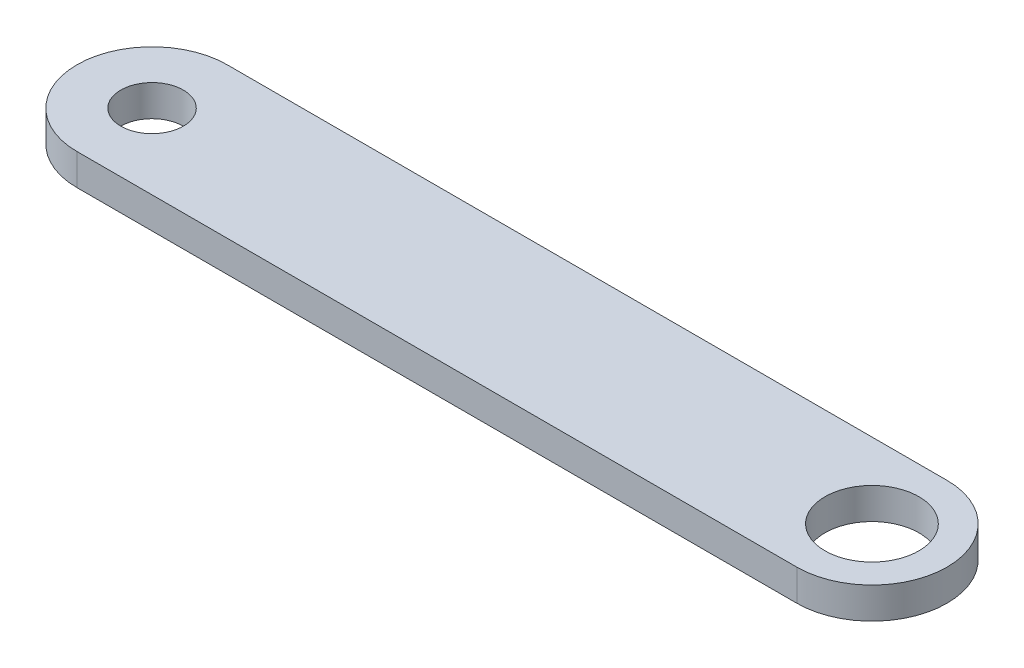
from build123d import *

# Parameters (mm, degrees)
SKETCH1_R           = 5
SKETCH1_R_2         = 7.5
BOSS_EXTRUDE1_DEPTH = 5
SCALE1_SCALE        = 0.25


with BuildPart() as part:
    # Sketch1 → Boss-Extrude1 (new body)
    with BuildSketch(Plane(origin=(0, 0, 0), x_dir=(1, 0, 0), z_dir=(0, 1, 0))):
        with BuildLine():
            Line((-57.5, 12), (57.5, 12))
            ThreePointArc((57.5, 12), (69.5, 0), (57.5, -12))
            Line((57.5, -12), (-57.5, -12))
            ThreePointArc((-57.5, -12), (-69.5, 0), (-57.5, 12))
        make_face()
        with Locations(Location((-57.5, 0, 0), (0, 0, 270))):
            Circle(SKETCH1_R, mode=Mode.SUBTRACT)
        with Locations(Location((57.5, 0, 0), (0, 0, 270))):
            Circle(SKETCH1_R_2, mode=Mode.SUBTRACT)
    extrude(amount=BOSS_EXTRUDE1_DEPTH)


with BuildPart() as part_1:
    # Scale1: scaled about (-1.908958981, 2.5, 0)
    add(part.part.scale(SCALE1_SCALE).moved(Location((-1.431719236, 1.875, 0))))


solid = part_1.part
